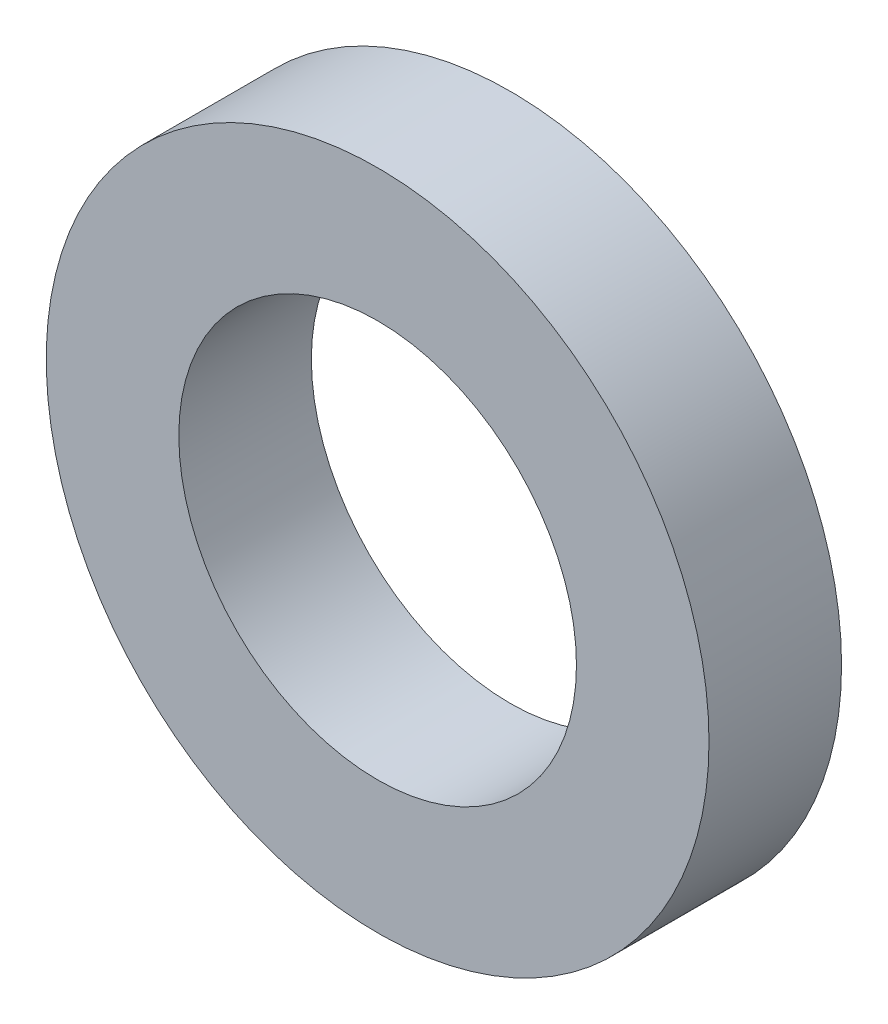
from build123d import *

# Parameters (mm, degrees)
SKETCH1_R           = 7.5
SKETCH1_R_2         = 4.5
BOSS_EXTRUDE1_DEPTH = 3


with BuildPart() as part:
    # Sketch1 → Boss-Extrude1 (new body)
    with BuildSketch(Plane.XY):
        Circle(SKETCH1_R)
        Circle(SKETCH1_R_2, mode=Mode.SUBTRACT)
    extrude(amount=BOSS_EXTRUDE1_DEPTH)


solid = part.part
